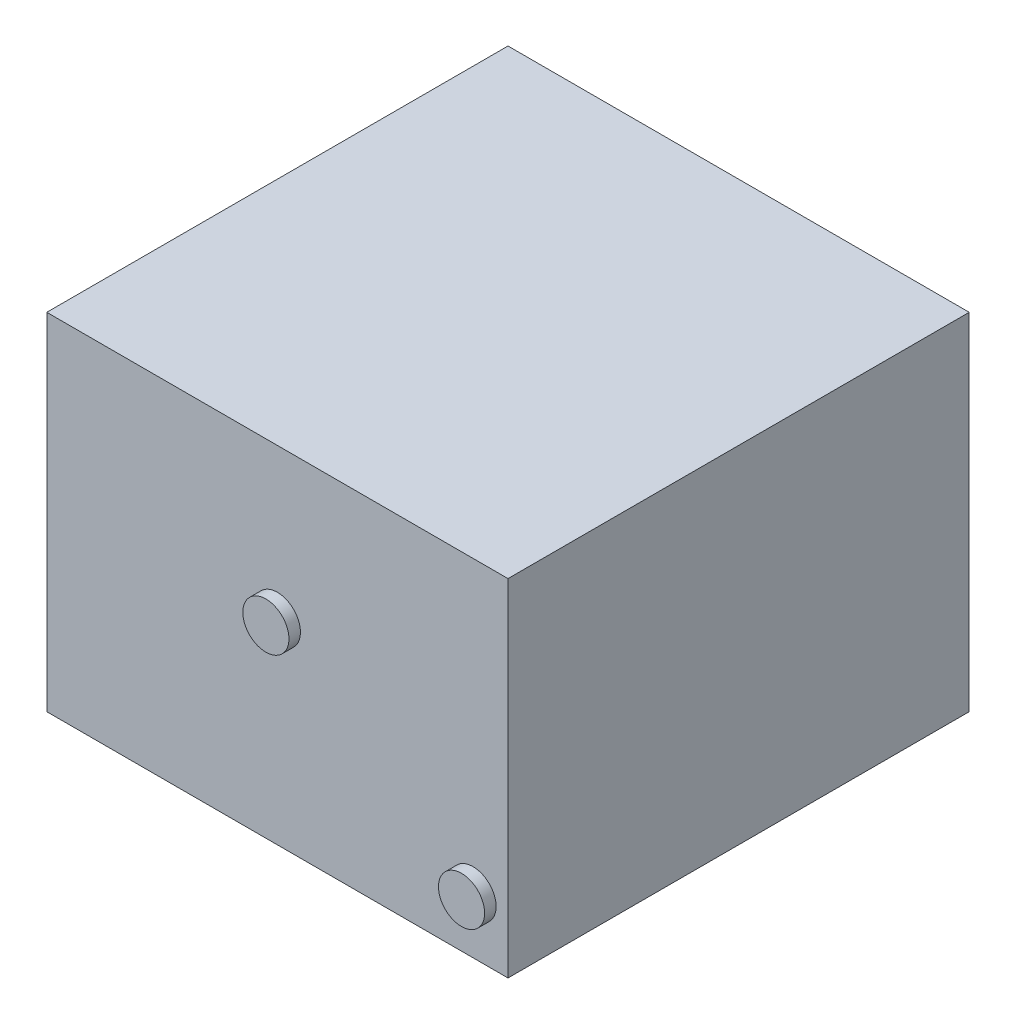
from build123d import *

# Parameters (mm, degrees)
SKETCH_1_W      = 200
SKETCH_1_H      = 150
EXTRUDE_1_DEPTH = 100
SKETCH_2_R      = 10
EXTRUDE_2_DEPTH = 5


with BuildPart() as part:
    # 草图1 → 凸台-拉伸1 (new, symmetric)
    with BuildSketch(Plane.XY):
        Rectangle(SKETCH_1_W, SKETCH_1_H)
    extrude(amount=EXTRUDE_1_DEPTH, both=True)

    # 草图2 → 凸台-拉伸2 (add)
    with BuildSketch(Plane.XY.offset(100)):
        with Locations(Location((0, 9.852813742, 0), (0, 0, 180))):
            Circle(SKETCH_2_R)
        with Locations(Location((84.852813742, -50.756338931, 0), (0, 0, 180))):
            Circle(SKETCH_2_R)
    extrude_2 = extrude(amount=EXTRUDE_2_DEPTH)

    # 镜向1: 凸台-拉伸2 across plane
    add(extrude_2.mirror(Plane.XY))


solid = part.part
